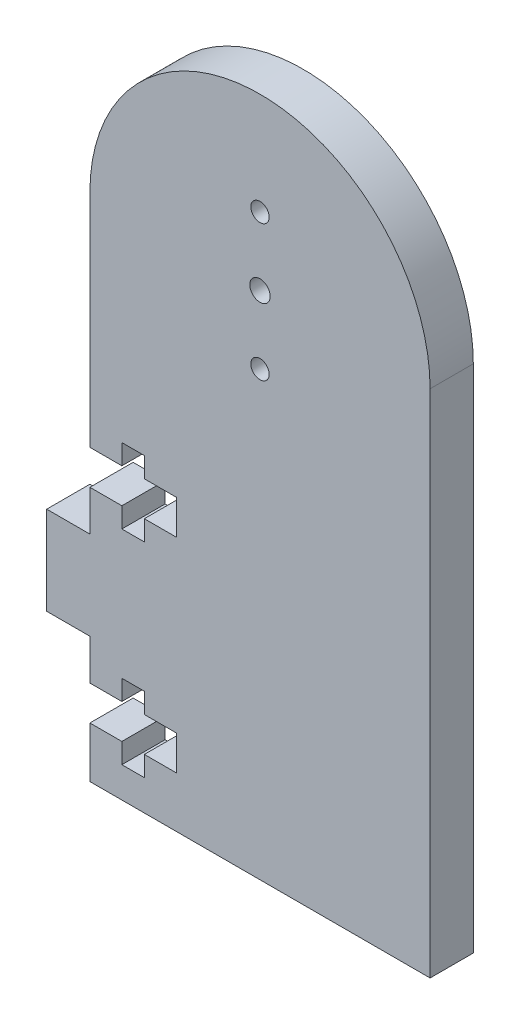
from build123d import *

# Parameters (mm, degrees)
BOSS_EXTRUDE1_DEPTH = 6.35
SKETCH2_R           = 1.5
SKETCH2_R_2         = 1.35
CUT_EXTRUDE1_DEPTH  = 80.311553383
CUT_EXTRUDE3_DEPTH  = 80.311553383
SKETCH7_W           = 6.35
SKETCH7_H           = 13
BOSS_EXTRUDE3_DEPTH = 6.35


with BuildPart() as part:
    # Sketch1 → Boss-Extrude1 (new body)
    with BuildSketch(Plane.XY):
        with BuildLine():
            Line((-25, 0), (-25, -75))
            Line((-25, -75), (25, -75))
            Line((25, -75), (25, 0))
            ThreePointArc((25, 0), (0, 25), (-25, 0))
        make_face()
    extrude(amount=BOSS_EXTRUDE1_DEPTH)

    # Sketch2 → Cut-Extrude1 (cut, through all)
    with BuildSketch(Plane.XY.offset(6.35)):
        Circle(SKETCH2_R)
        with Locations((0, 10)):
            Circle(SKETCH2_R_2)
        with Locations((0, -10)):
            Circle(SKETCH2_R_2)
    extrude(amount=-CUT_EXTRUDE1_DEPTH, mode=Mode.SUBTRACT)

    # Sketch6 → Cut-Extrude3 (cut, through all)
    with BuildSketch(Plane.XY.offset(6.35)):
        Polygon((-12.3, -67.54), (-16.999, -67.54), (-16.999, -70.4991), (-20.301, -70.4991), (-20.301, -67.54), (-25, -67.54), (-25, -62.46), (-20.301, -62.46), (-20.301, -59.5009), (-16.999, -59.5009), (-16.999, -62.46), (-12.3, -62.46), align=None)
        Polygon((-12.3, -37.54), (-16.999, -37.54), (-16.999, -40.4991), (-20.301, -40.4991), (-20.301, -37.54), (-25, -37.54), (-25, -32.46), (-20.301, -32.46), (-20.301, -29.5009), (-16.999, -29.5009), (-16.999, -32.46), (-12.3, -32.46), align=None)
    extrude(amount=-CUT_EXTRUDE3_DEPTH, mode=Mode.SUBTRACT)

    # Sketch7 → Boss-Extrude3 (add)
    with BuildSketch(Plane.XY.offset(6.35)):
        with Locations((-28.175, -50)):
            Rectangle(SKETCH7_W, SKETCH7_H)
    extrude(amount=-BOSS_EXTRUDE3_DEPTH)


solid = part.part
